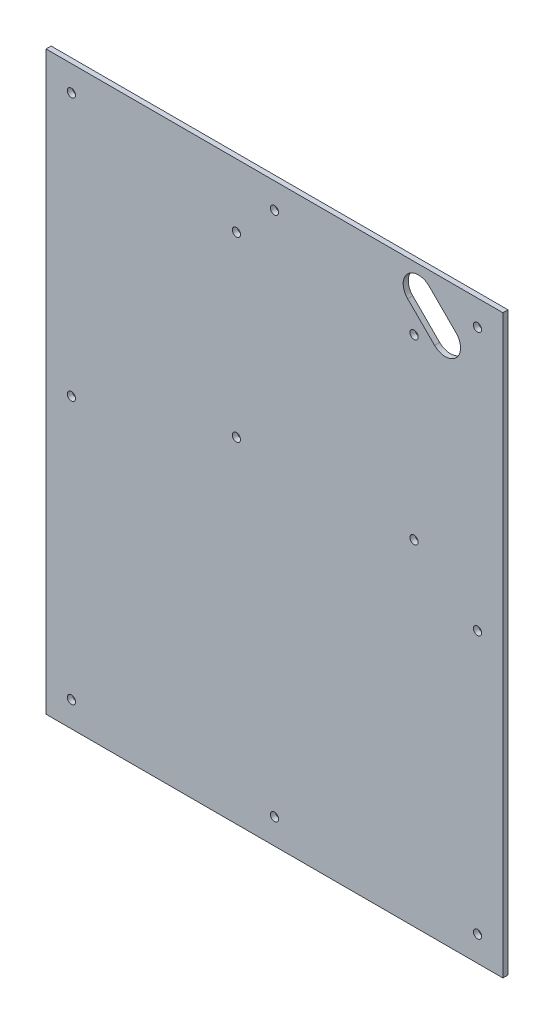
from build123d import *

# Parameters (mm, degrees)
SKETCH_1_W      = 180
SKETCH_1_H      = 227
SKETCH_1_R      = 1.625
EXTRUDE_1_DEPTH = 2


with BuildPart() as part:
    # 草图1 → 凸台-拉伸1 (new body)
    with BuildSketch(Plane.XY):
        Rectangle(SKETCH_1_W, SKETCH_1_H)
        with Locations((-15, 88.5)):
            Circle(SKETCH_1_R, mode=Mode.SUBTRACT)
        with Locations((55, 88.5)):
            Circle(SKETCH_1_R, mode=Mode.SUBTRACT)
        with Locations((55, 18.5)):
            Circle(SKETCH_1_R, mode=Mode.SUBTRACT)
        with Locations((-15, 18.5)):
            Circle(SKETCH_1_R, mode=Mode.SUBTRACT)
        with Locations((-80, 103.5)):
            Circle(SKETCH_1_R, mode=Mode.SUBTRACT)
        with Locations((0, 103.5)):
            Circle(SKETCH_1_R, mode=Mode.SUBTRACT)
        with Locations((80, 103.5)):
            Circle(SKETCH_1_R, mode=Mode.SUBTRACT)
        with Locations((80, -103.5)):
            Circle(SKETCH_1_R, mode=Mode.SUBTRACT)
        with Locations((0, -103.5)):
            Circle(SKETCH_1_R, mode=Mode.SUBTRACT)
        with Locations((-80, -103.5)):
            Circle(SKETCH_1_R, mode=Mode.SUBTRACT)
        with Locations((80, 0)):
            Circle(SKETCH_1_R, mode=Mode.SUBTRACT)
        with Locations((-80, 0)):
            Circle(SKETCH_1_R, mode=Mode.SUBTRACT)
        with BuildLine():
            Line((63.076132364, 88.90914901), (52.469530647, 99.515750728))
            ThreePointArc((52.469530647, 99.515750728), (52.469530647, 108.001032102), (60.954812021, 108.001032102))
            Line((60.954812021, 108.001032102), (71.561413739, 97.394430384))
            ThreePointArc((71.561413739, 97.394430384), (71.561413739, 88.90914901), (63.076132364, 88.90914901))
        make_face(mode=Mode.SUBTRACT)
    extrude(amount=EXTRUDE_1_DEPTH)


solid = part.part
